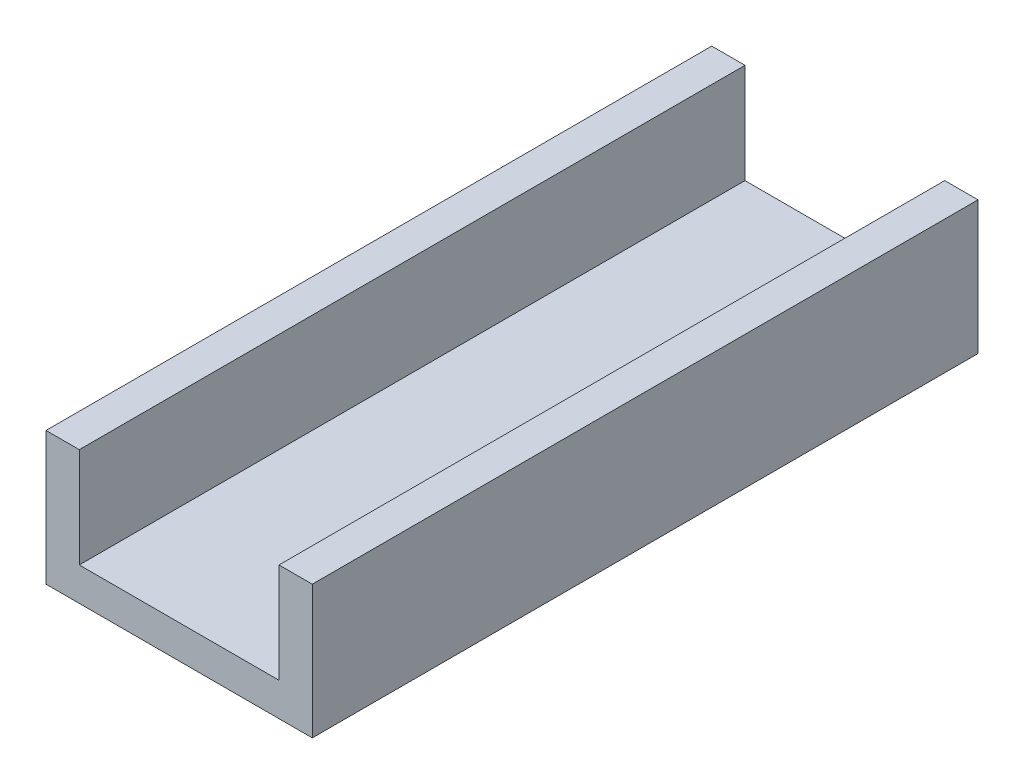
from build123d import *

# Parameters (mm, degrees)
EXTRUDE_THIN1_DEPTH = 200


with BuildPart() as part:
    # Sketch1 → Extrude-Thin1 (new body)
    with BuildSketch(Plane.XY):
        Polygon((0, 30), (0, 0), (60, 0), (60, 30), (70, 30), (70, -10), (-10, -10), (-10, 30), align=None)
    extrude(amount=EXTRUDE_THIN1_DEPTH)


solid = part.part
